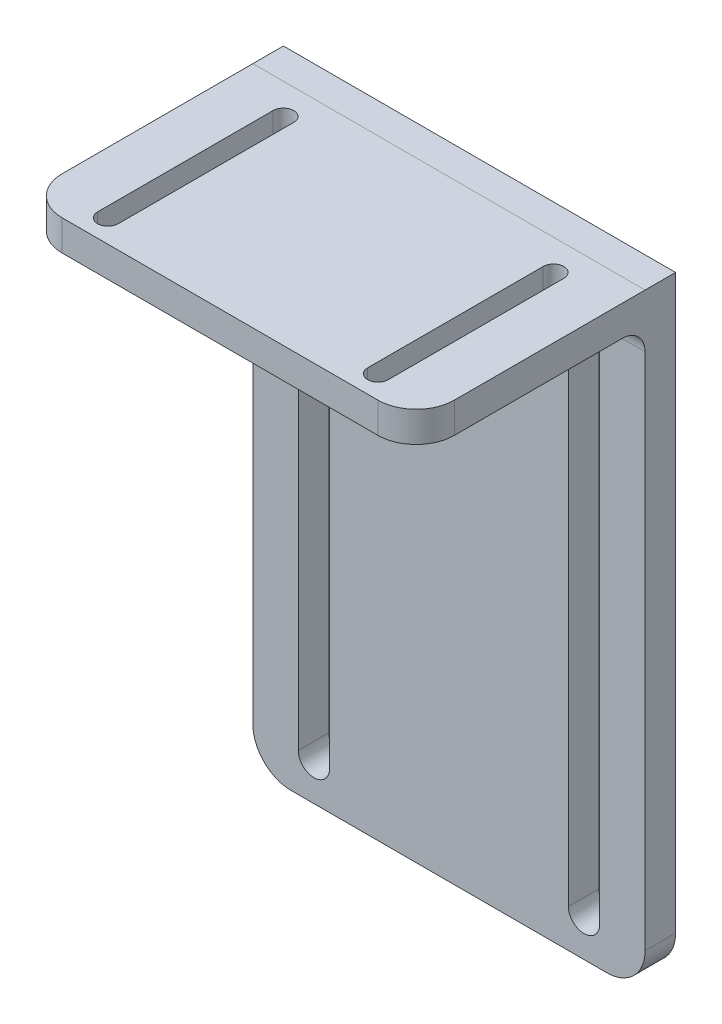
from build123d import *

# Parameters (mm, degrees)
SKETCH2_W           = 51.4
SKETCH2_H           = 80
BOSS_EXTRUDE1_DEPTH = 4
SKETCH3_W           = 51.4
SKETCH3_H           = 4
BOSS_EXTRUDE2_DEPTH = 30
CUT_EXTRUDE1_DEPTH  = 101.997894739
FILLET1_R           = 5
FILLET2_R           = 3


with BuildPart() as part:
    # Sketch2 → Boss-Extrude1 (new body)
    with BuildSketch(Plane.XY):
        with Locations((25.725149861, -37.544031409)):
            Rectangle(SKETCH2_W, SKETCH2_H)
        with BuildLine():
            Line((10.075149861, -7.544031409), (10.075149861, -72.544031409))
            ThreePointArc((10.075149861, -72.544031409), (8.025149861, -74.594031409), (5.975149861, -72.544031409))
            Line((5.975149861, -72.544031409), (5.975149861, -7.544031409))
            ThreePointArc((5.975149861, -7.544031409), (8.025149861, -5.494031409), (10.075149861, -7.544031409))
        make_face(mode=Mode.SUBTRACT)
        with BuildLine():
            Line((41.375149861, -72.544031409), (41.375149861, -7.544031409))
            ThreePointArc((41.375149861, -7.544031409), (43.425149861, -5.494031409), (45.475149861, -7.544031409))
            Line((45.475149861, -7.544031409), (45.475149861, -72.544031409))
            ThreePointArc((45.475149861, -72.544031409), (43.425149861, -74.594031409), (41.375149861, -72.544031409))
        make_face(mode=Mode.SUBTRACT)
    extrude(amount=BOSS_EXTRUDE1_DEPTH)

    # Sketch3 → Boss-Extrude2 (add)
    with BuildSketch(Plane.XY.offset(4)):
        with Locations((25.725149861, 0.456147987)):
            Rectangle(SKETCH3_W, SKETCH3_H)
    extrude(amount=BOSS_EXTRUDE2_DEPTH)

    # Sketch4 → Cut-Extrude1 (cut, through all)
    with BuildSketch(Plane(origin=(0, 2.456147987, 0), x_dir=(1, 0, 0), z_dir=(0, 1, 0))):
        with BuildLine():
            Line((9.375149861, -8), (9.375149861, -31))
            ThreePointArc((9.375149861, -31), (8.025149861, -32.35), (6.675149861, -31))
            Line((6.675149861, -31), (6.675149861, -8))
            ThreePointArc((6.675149861, -8), (8.025149861, -6.65), (9.375149861, -8))
        make_face()
        with BuildLine():
            Line((42.075149861, -31), (42.075149861, -8))
            ThreePointArc((42.075149861, -8), (43.425149861, -6.65), (44.775149861, -8))
            Line((44.775149861, -8), (44.775149861, -31))
            ThreePointArc((44.775149861, -31), (43.425149861, -32.35), (42.075149861, -31))
        make_face()
    extrude(amount=-CUT_EXTRUDE1_DEPTH, mode=Mode.SUBTRACT)

    # Fillet1
    fillet1_edges = [part.edges().sort_by_distance(p)[0] for p in [
        (0.025149861, 0.456147987, 34),
        (51.425149861, 0.456147987, 34),
        (51.425149861, -77.544031409, 2),
        (0.025149861, -77.544031409, 2),
    ]]
    fillet(fillet1_edges, radius=FILLET1_R)

    # Fillet2
    fillet2_edges = [part.edges().sort_by_distance(p)[0] for p in [
        (25.725149861, -1.543852013, 4),
    ]]
    fillet(fillet2_edges, radius=FILLET2_R)


solid = part.part
